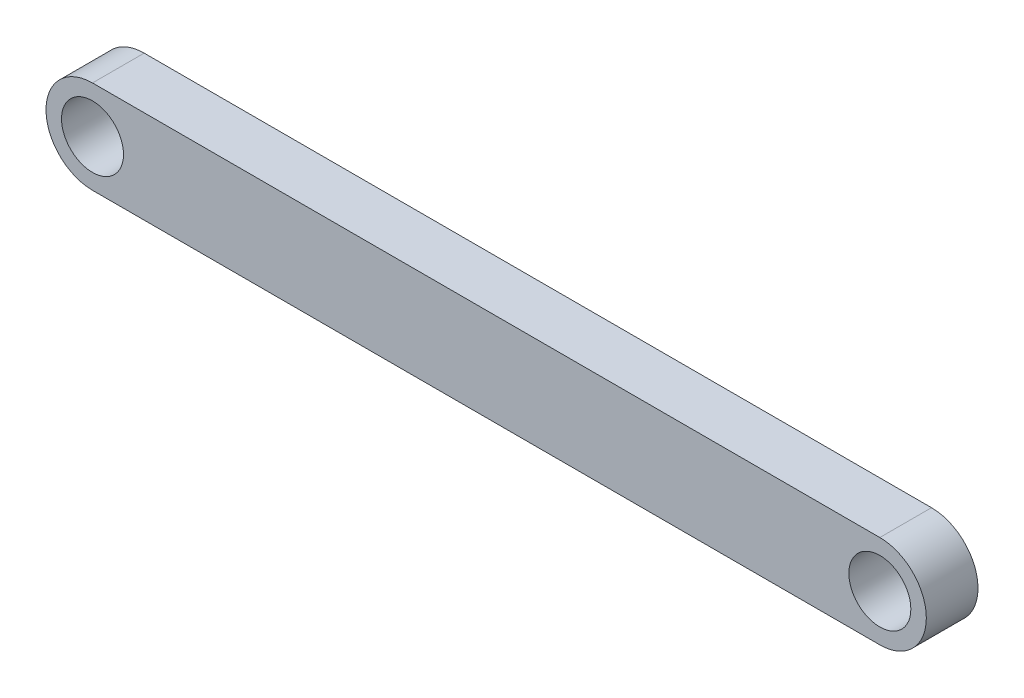
from build123d import *

# Parameters (mm, degrees)
BOSS_EXTRUDE2_DEPTH = 5
SKETCH2_R           = 3
CUT_EXTRUDE1_DEPTH  = 44.12783324


with BuildPart() as part:
    # Sketch1 → Boss-Extrude2 (new body)
    with BuildSketch(Plane.XY):
        with BuildLine():
            Line((38.1, -4.5), (-38.1, -4.5))
            ThreePointArc((-38.1, -4.5), (-42.6, 0), (-38.1, 4.5))
            Line((-38.1, 4.5), (38.1, 4.5))
            ThreePointArc((38.1, 4.5), (42.6, 0), (38.1, -4.5))
        make_face()
    extrude(amount=BOSS_EXTRUDE2_DEPTH)

    # Sketch2 → Cut-Extrude1 (cut, through all)
    with BuildSketch(Plane.XY.offset(5)):
        with Locations((-38.1, 0)):
            Circle(SKETCH2_R)
        with Locations((38.1, 0)):
            Circle(SKETCH2_R)
    extrude(amount=-CUT_EXTRUDE1_DEPTH, mode=Mode.SUBTRACT)


solid = part.part
